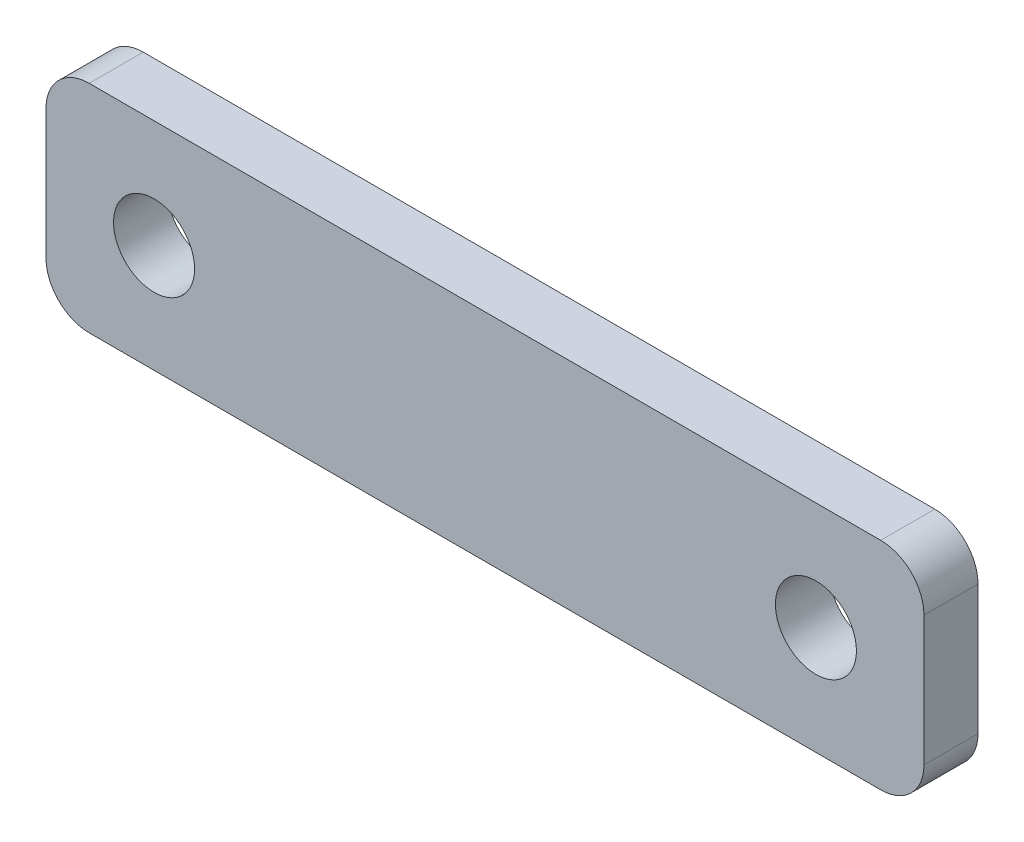
from build123d import *

# Parameters (mm, degrees)
SKETCH1_W           = 103.1875
SKETCH1_H           = 25.4
BOSS_EXTRUDE1_DEPTH = 6.35
FILLET1_R           = 5.08
SKETCH2_R           = 4.7625
CUT_EXTRUDE1_DEPTH  = 107.457233931


with BuildPart() as part:
    # Sketch1 → Boss-Extrude1 (new body)
    with BuildSketch(Plane.XY):
        with Locations((51.59375, 12.7)):
            Rectangle(SKETCH1_W, SKETCH1_H)
    extrude(amount=-BOSS_EXTRUDE1_DEPTH)

    # Fillet1
    fillet1_edges = [part.edges().sort_by_distance(p)[0] for p in [
        (0, 25.4, -3.175),
        (103.1875, 25.4, -3.175),
        (103.1875, 0, -3.175),
        (0, 0, -3.175),
    ]]
    fillet(fillet1_edges, radius=FILLET1_R)

    # Sketch2 → Cut-Extrude1 (cut, through all)
    with BuildSketch(Plane.XY):
        with Locations((12.7, 12.7)):
            Circle(SKETCH2_R)
        with Locations((90.4875, 12.7)):
            Circle(SKETCH2_R)
    extrude(amount=-CUT_EXTRUDE1_DEPTH, mode=Mode.SUBTRACT)


solid = part.part
